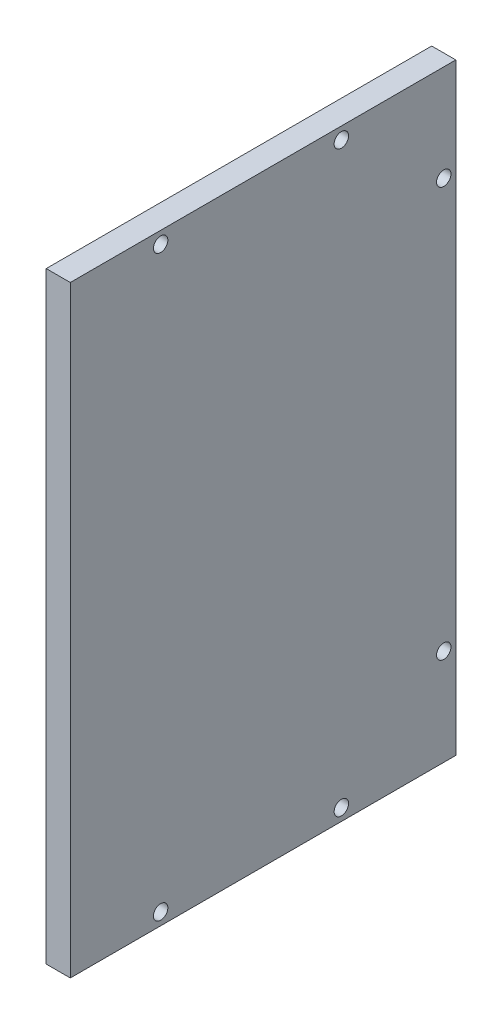
from build123d import *

# Parameters (mm, degrees)
SKETCH1_W             = 101.6
SKETCH1_H             = 158.75
BOSS_EXTRUDE1_DEPTH   = 6.35
F_6_CLEARANCE_HOLE1_D = 3.7973


with BuildPart() as part:
    # Sketch1 → Boss-Extrude1 (new body)
    with BuildSketch(Plane(origin=(0, 0, 0), x_dir=(0, 0, -1), z_dir=(1, 0, 0))):
        Rectangle(SKETCH1_W, SKETCH1_H)
    extrude(amount=BOSS_EXTRUDE1_DEPTH)

    # #6 Clearance Hole1 (through all)
    with Locations(Plane.ZY):
        with Locations((-47.625, 53.975), (-20.6375, 76.2), (26.9875, 76.2), (26.9875, -76.2), (-20.6375, -76.2), (-47.625, -53.975)):
            Hole(F_6_CLEARANCE_HOLE1_D / 2)


solid = part.part
